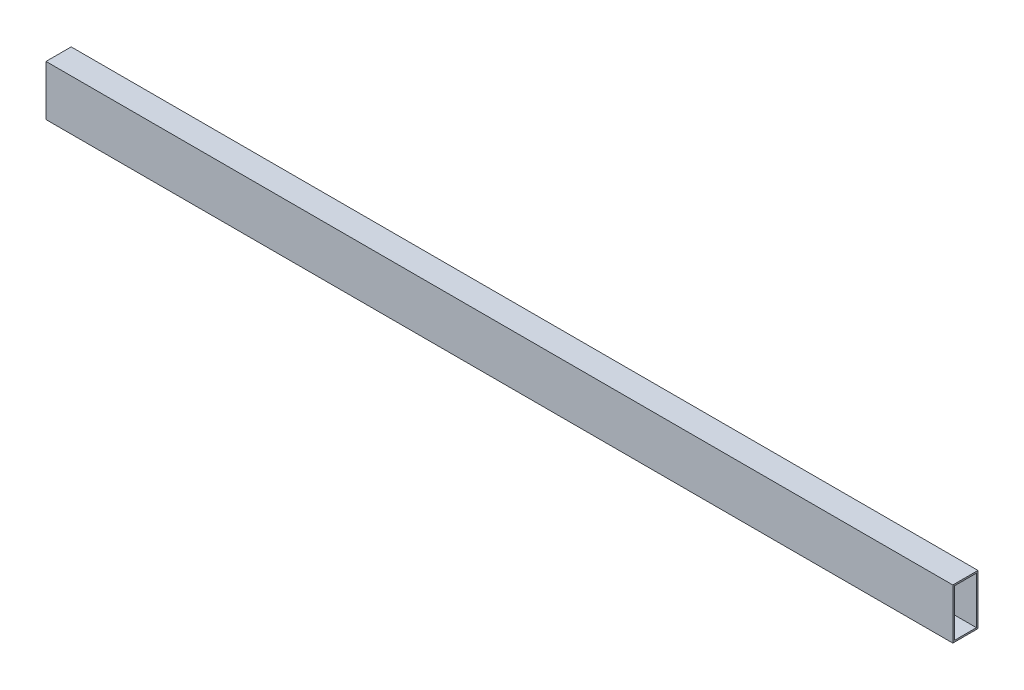
from build123d import *

# Parameters (mm, degrees)
SKETCH1_W           = 25.4
SKETCH1_H           = 50.8
SKETCH1_W_2         = 22.225
SKETCH1_H_2         = 47.625
BOSS_EXTRUDE1_DEPTH = 457.2


with BuildPart() as part:
    # Sketch1 → Boss-Extrude1 (new, symmetric)
    with BuildSketch(Plane(origin=(0, 0, 0), x_dir=(0, 0, -1), z_dir=(1, 0, 0))):
        with Locations((1.923003206, 0)):
            Rectangle(SKETCH1_W, SKETCH1_H)
        with Locations((1.923003206, 0)):
            Rectangle(SKETCH1_W_2, SKETCH1_H_2, mode=Mode.SUBTRACT)
    extrude(amount=BOSS_EXTRUDE1_DEPTH, both=True)


solid = part.part
